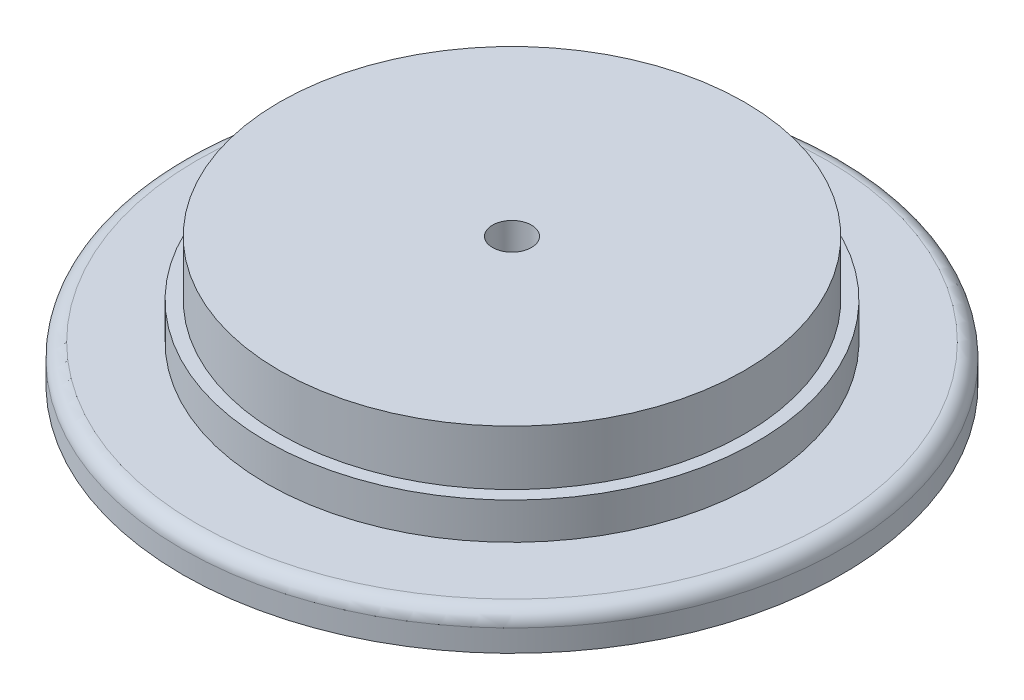
from build123d import *

# Parameters (mm, degrees)
SKETCH1_R                                           = 40.3225
BOSS_EXTRUDE1_DEPTH                                 = 9.525
SKETCH2_R                                           = 42.545
BOSS_EXTRUDE2_DEPTH                                 = 6.35
SKETCH3_R                                           = 57.15
BOSS_EXTRUDE3_DEPTH                                 = 6.35
FILLET2_R                                           = 2.54
CSK_FOR_1_4_FLAT_HEAD_MACHINE_SCREW_100_D           = 6.7564
CSK_FOR_1_4_FLAT_HEAD_MACHINE_SCREW_100_CSINK_D     = 12.8778
CSK_FOR_1_4_FLAT_HEAD_MACHINE_SCREW_100_CSINK_ANGLE = 100


with BuildPart() as part:
    # Sketch1 → Boss-Extrude1 (new body)
    with BuildSketch(Plane(origin=(0, 0, 0), x_dir=(1, 0, 0), z_dir=(0, 1, 0))):
        with Locations(Location((0, 0, 0), (0, 0, 90))):
            Circle(SKETCH1_R)
    extrude(amount=BOSS_EXTRUDE1_DEPTH)

    # Sketch2 → Boss-Extrude2 (add)
    with BuildSketch(Plane.XZ):
        with Locations(Location((0, 0, 0), (0, 0, 270))):
            Circle(SKETCH2_R)
    extrude(amount=BOSS_EXTRUDE2_DEPTH)

    # Sketch3 → Boss-Extrude3 (add)
    with BuildSketch(Plane.XZ.offset(6.35)):
        with Locations(Location((0, 0, 0), (0, 0, 270))):
            Circle(SKETCH3_R)
    extrude(amount=BOSS_EXTRUDE3_DEPTH)

    # Fillet2
    fillet2_edges = [part.edges().sort_by_distance(p)[0] for p in [
        (0, -6.35, 57.15),
    ]]
    fillet(fillet2_edges, radius=FILLET2_R)

    # CSK for 1/4 Flat Head Machine Screw (100)1 (through all)
    with Locations(Plane(origin=(0, -12.7, 0), x_dir=(0, 0, -1), z_dir=(0, -1, 0))):
        with Locations((0, 0)):
            CounterSinkHole(CSK_FOR_1_4_FLAT_HEAD_MACHINE_SCREW_100_D / 2, CSK_FOR_1_4_FLAT_HEAD_MACHINE_SCREW_100_CSINK_D / 2, counter_sink_angle=CSK_FOR_1_4_FLAT_HEAD_MACHINE_SCREW_100_CSINK_ANGLE)


solid = part.part
